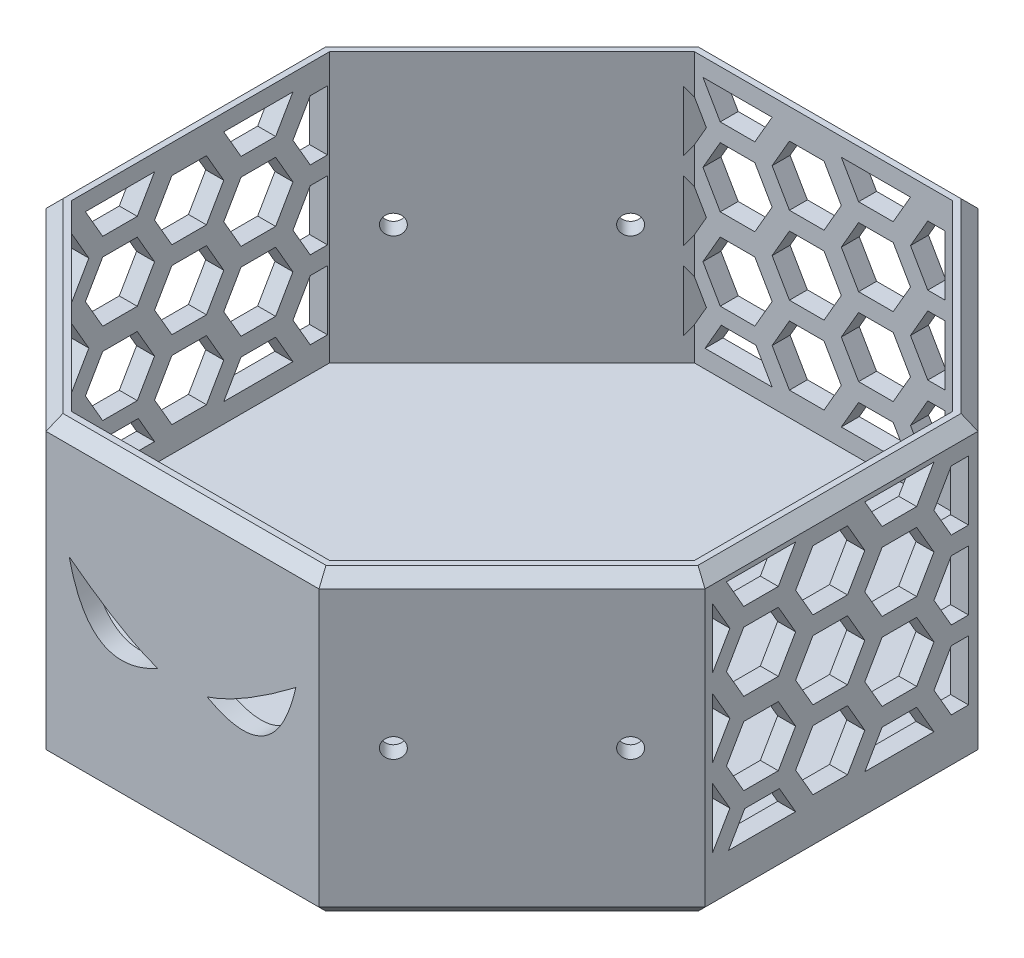
from build123d import *

# Parameters (mm, degrees)
RESSALTO_EXTRUS_O1_DEPTH = 50
CORTE_EXTRUS_O2_DEPTH    = 45
ESBO_O14_R               = 1.65
CORTE_EXTRUS_O6_DEPTH    = 142.883727229
ESBO_O15_R               = 1.65
CORTE_EXTRUS_O7_DEPTH    = 142.883727229
CHANFRO1_SIZE            = 2
CORTE_EXTRUS_O3_DEPTH    = 133.759180474
CORTE_EXTRUS_O4_DEPTH    = 10
CORTE_EXTRUS_O5_DEPTH    = 10


with BuildPart() as part:
    # Esboço1 → Ressalto-extrusão1 (new body)
    with BuildSketch(Plane(origin=(0, 0, 0), x_dir=(1, 0, 0), z_dir=(0, 1, 0))):
        Polygon((55, -22.781745931), (55, 22.781745931), (22.781745931, 55), (-22.781745931, 55), (-55, 22.781745931), (-55, -22.781745931), (-22.781745931, -55), (22.781745931, -55), align=None)
    extrude(amount=RESSALTO_EXTRUS_O1_DEPTH)

    # Esboço2 → Corte-extrusão2 (cut)
    with BuildSketch(Plane(origin=(0, 50, 0), x_dir=(1, 0, 0), z_dir=(0, 1, 0))):
        Polygon((52, 21.539105243), (21.539105243, 52), (-21.539105243, 52), (-52, 21.539105243), (-52, -21.539105243), (-21.539105243, -52), (21.539105243, -52), (52, -21.539105243), align=None)
    extrude(amount=-CORTE_EXTRUS_O2_DEPTH, mode=Mode.SUBTRACT)

    # Esboço14 → Corte-extrusão6 (cut, through all)
    with BuildSketch(Plane(origin=(-38.890872965, 0, 38.890872965), x_dir=(0.7071067811865474, 0, 0.7071067811865477), z_dir=(-0.7071067811865477, 0, 0.7071067811865474))):
        with Locations((-14, 25)):
            Circle(ESBO_O14_R)
        with Locations((14, 25)):
            Circle(ESBO_O14_R)
    extrude(amount=-CORTE_EXTRUS_O6_DEPTH, mode=Mode.SUBTRACT)

    # Esboço15 → Corte-extrusão7 (cut, through all)
    with BuildSketch(Plane(origin=(-38.890872965, 0, -38.890872965), x_dir=(-0.7071067811865478, 0, 0.7071067811865472), z_dir=(-0.7071067811865472, 0, -0.7071067811865478))):
        with Locations((-14, 25)):
            Circle(ESBO_O15_R)
        with Locations((14, 25)):
            Circle(ESBO_O15_R)
    extrude(amount=-CORTE_EXTRUS_O7_DEPTH, mode=Mode.SUBTRACT)

    # Chanfro1
    chanfro1_edges = [part.edges().sort_by_distance(p)[0] for p in [
        (0, 0, -55),
        (38.890872965, 0, -38.890872965),
        (55, 0, 0),
        (38.890872965, 0, 38.890872965),
        (38.890872965, 50, -38.890872965),
        (0, 50, -55),
        (-38.890872965, 50, -38.890872965),
        (-55, 50, 0),
        (-38.890872965, 50, 38.890872965),
        (0, 50, 55),
        (38.890872965, 50, 38.890872965),
        (0, 0, 55),
        (55, 50, 0),
        (-38.890872965, 0, 38.890872965),
        (-55, 0, 0),
        (-38.890872965, 0, -38.890872965),
    ]]
    chamfer(chanfro1_edges, length=CHANFRO1_SIZE)

    # Esboço11 → Corte-extrusão3 (cut, through all)
    with BuildSketch(Plane.ZY.offset(55)):
        Polygon((18.862017185, 8.239613046), (16.148516283, 12.939534476), (10.375013591, 12.939534476), (7.661512689, 8.239613046), align=None)
        Polygon((7.661512689, 27.239613046), (4.774761343, 32.239613046), (-0.998741349, 32.239613046), (-3.885492695, 27.239613046), (-0.998741349, 22.239613046), (4.774761343, 22.239613046), align=None)
        Polygon((-3.885492695, 21.239613046), (-6.772244041, 26.239613046), (-12.545746733, 26.239613046), (-15.432498079, 21.239613046), (-12.545746733, 16.239613046), (-6.772244041, 16.239613046), align=None)
        Polygon((7.661512689, 40.239613046), (4.774761343, 45.239613046), (-0.998741349, 45.239613046), (-3.885492695, 40.239613046), (-0.998741349, 35.239613046), (4.774761343, 35.239613046), align=None)
        Polygon((7.661512689, 14.239613046), (4.774761343, 19.239613046), (-0.998741349, 19.239613046), (-3.885492695, 14.239613046), (-0.998741349, 9.239613046), (4.774761343, 9.239613046), align=None)
        Polygon((-15.432498079, 8.239613046), (-3.885492695, 8.239613046), (-6.772244041, 13.239613046), (-12.545746733, 13.239613046), align=None)
        Polygon((-15.432498079, 47.239613046), (-3.885492695, 47.239613046), (-6.772244041, 42.239613046), (-12.545746733, 42.239613046), align=None)
        Polygon((-3.885492695, 34.239613046), (-6.772244041, 39.239613046), (-12.545746733, 39.239613046), (-15.432498079, 34.239613046), (-12.545746733, 29.239613046), (-6.772244041, 29.239613046), align=None)
        Polygon((-21.206000771, 45.239613046), (-21.206000771, 35.239613046), (-18.319249425, 35.239613046), (-15.432498079, 40.239613046), (-18.319249425, 45.239613046), align=None)
        Polygon((-15.432498079, 27.239613046), (-18.319249425, 32.239613046), (-21.206000771, 32.239613046), (-21.206000771, 22.239613046), (-18.319249425, 22.239613046), align=None)
        Polygon((-15.432498079, 14.239613046), (-18.319249425, 19.239613046), (-21.206000771, 19.239613046), (-21.206000771, 9.239613046), (-18.319249425, 9.239613046), align=None)
        Polygon((19.208518072, 34.239613046), (16.321766726, 39.239613046), (10.548264034, 39.239613046), (7.661512689, 34.239613046), (10.548264034, 29.239613046), (16.321766726, 29.239613046), align=None)
        Polygon((7.661512689, 47.239613046), (10.548264034, 42.239613046), (16.321766726, 42.239613046), (19.208518072, 47.239613046), align=None)
        Polygon((21.517919149, 45.239613046), (21.517919149, 35.239613046), (18.631167803, 40.239613046), align=None)
        Polygon((19.208518072, 20.602829594), (16.321766726, 25.602829594), (10.548264034, 25.602829594), (7.661512689, 20.602829594), (10.548264034, 15.602829594), (16.321766726, 15.602829594), align=None)
        Polygon((21.517919149, 32.239613046), (21.517919149, 22.239613046), (18.631167803, 27.239613046), align=None)
        Polygon((21.517919149, 19.239613046), (21.517919149, 9.239613046), (18.631167803, 14.239613046), align=None)
    extrude(amount=-CORTE_EXTRUS_O3_DEPTH, mode=Mode.SUBTRACT)

    # Esboço12 → Corte-extrusão4 (cut)
    with BuildSketch(Plane(origin=(0, 0, -55), x_dir=(-1, 0, 0), z_dir=(0, 0, -1))):
        Polygon((19.781745931, 8), (17.068245028, 12.699921429), (11.294742336, 12.699921429), (8.581241434, 8), align=None)
        Polygon((8.581241434, 27), (5.694490088, 32), (-0.079012604, 32), (-2.96576395, 27), (-0.079012604, 22), (5.694490088, 22), align=None)
        Polygon((-2.96576395, 21), (-5.852515296, 26), (-11.626017988, 26), (-14.512769334, 21), (-11.626017988, 16), (-5.852515296, 16), align=None)
        Polygon((8.581241434, 40), (5.694490088, 45), (-0.079012604, 45), (-2.96576395, 40), (-0.079012604, 35), (5.694490088, 35), align=None)
        Polygon((8.581241434, 14), (5.694490088, 19), (-0.079012604, 19), (-2.96576395, 14), (-0.079012604, 9), (5.694490088, 9), align=None)
        Polygon((-14.512769334, 8), (-2.96576395, 8), (-5.852515296, 13), (-11.626017988, 13), align=None)
        Polygon((-14.512769334, 47), (-2.96576395, 47), (-5.852515296, 42), (-11.626017988, 42), align=None)
        Polygon((-2.96576395, 34), (-5.852515296, 39), (-11.626017988, 39), (-14.512769334, 34), (-11.626017988, 29), (-5.852515296, 29), align=None)
        Polygon((-20.286272026, 45), (-20.286272026, 35), (-17.39952068, 35), (-14.512769334, 40), (-17.39952068, 45), align=None)
        Polygon((-14.512769334, 27), (-17.39952068, 32), (-20.286272026, 32), (-20.286272026, 22), (-17.39952068, 22), align=None)
        Polygon((-14.512769334, 14), (-17.39952068, 19), (-20.286272026, 19), (-20.286272026, 9), (-17.39952068, 9), align=None)
        Polygon((20.128246818, 34), (17.241495472, 39), (11.46799278, 39), (8.581241434, 34), (11.46799278, 29), (17.241495472, 29), align=None)
        Polygon((8.581241434, 47), (11.46799278, 42), (17.241495472, 42), (20.128246818, 47), align=None)
        Polygon((22.437647894, 45), (22.437647894, 35), (19.550896548, 40), align=None)
        Polygon((20.128246818, 20.363216547), (17.241495472, 25.363216547), (11.46799278, 25.363216547), (8.581241434, 20.363216547), (11.46799278, 15.363216547), (17.241495472, 15.363216547), align=None)
        Polygon((22.437647894, 32), (22.437647894, 22), (19.550896548, 27), align=None)
        Polygon((22.437647894, 19), (22.437647894, 9), (19.550896548, 14), align=None)
    extrude(amount=-CORTE_EXTRUS_O4_DEPTH, mode=Mode.SUBTRACT)

    # Esboço13 → Corte-extrusão5 (cut)
    with BuildSketch(Plane.XY.offset(55)):
        with BuildLine():
            add(Edge.make_bspline(
                [(-18.917899523, 31.812800079), (-9.790862328, 24.903720312), (-4.10744427, 23.050598788)],
                knots=[0, 0, 0, 1, 1, 1], degree=2))
            add(Edge.make_bspline(
                [(-18.917899523, 31.812800079), (-15.516774887, 16.806948828), (-4.10744427, 23.050598788)],
                knots=[0, 0, 0, 1, 1, 1], degree=2))
        make_face()
        with BuildLine():
            add(Edge.make_bspline(
                [(18.917899523, 31.812800079), (9.790862328, 24.903720312), (4.10744427, 23.050598788)],
                knots=[0, 0, 0, 1, 1, 1], degree=2))
            add(Edge.make_bspline(
                [(18.917899523, 31.812800079), (15.516774887, 16.806948828), (4.10744427, 23.050598788)],
                knots=[0, 0, 0, 1, 1, 1], degree=2))
        make_face()
    extrude(amount=-CORTE_EXTRUS_O5_DEPTH, mode=Mode.SUBTRACT)


solid = part.part
